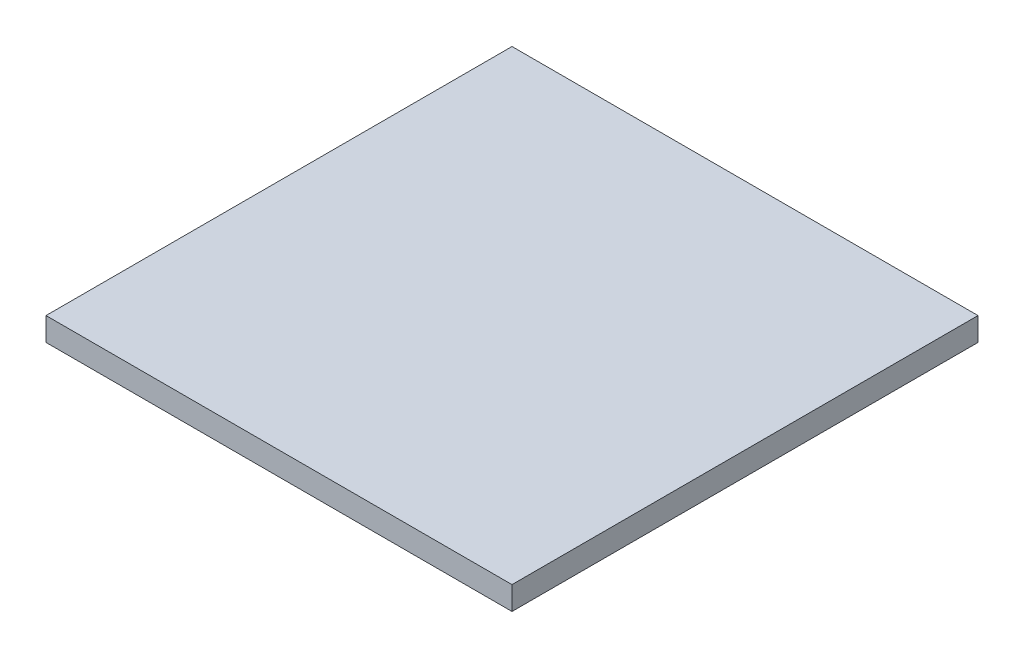
from build123d import *

# Parameters (mm, degrees)
OUTLINE_W           = 100
OUTLINE_H           = 100
BOSS_EXTRUDE1_DEPTH = 4.5
SKETCH3_OUTSIDE_W   = 130.298
SKETCH3_OUTSIDE_H   = 130.298
SKETCH3_OUTSIDE_W_2 = 90
SKETCH3_OUTSIDE_H_2 = 90
CUT_EXTRUDE2_DEPTH  = 128.358745283


with BuildPart() as part:
    # Outline → Boss-Extrude1 (new body)
    with BuildSketch(Plane(origin=(0, 0, 0), x_dir=(1, 0, 0), z_dir=(0, 1, 0))):
        with Locations((40, -40)):
            Rectangle(OUTLINE_W, OUTLINE_H)
    extrude(amount=BOSS_EXTRUDE1_DEPTH)

    # Sketch3 outside → Cut-Extrude2 (cut, through all)
    with BuildSketch(Plane(origin=(0, 4.5, 0), x_dir=(1, 0, 0), z_dir=(0, 1, 0))):
        with Locations((40, -40)):
            Rectangle(SKETCH3_OUTSIDE_W, SKETCH3_OUTSIDE_H)
        with Locations((40, -40)):
            Rectangle(SKETCH3_OUTSIDE_W_2, SKETCH3_OUTSIDE_H_2, mode=Mode.SUBTRACT)
    extrude(amount=-CUT_EXTRUDE2_DEPTH, mode=Mode.SUBTRACT)


solid = part.part
